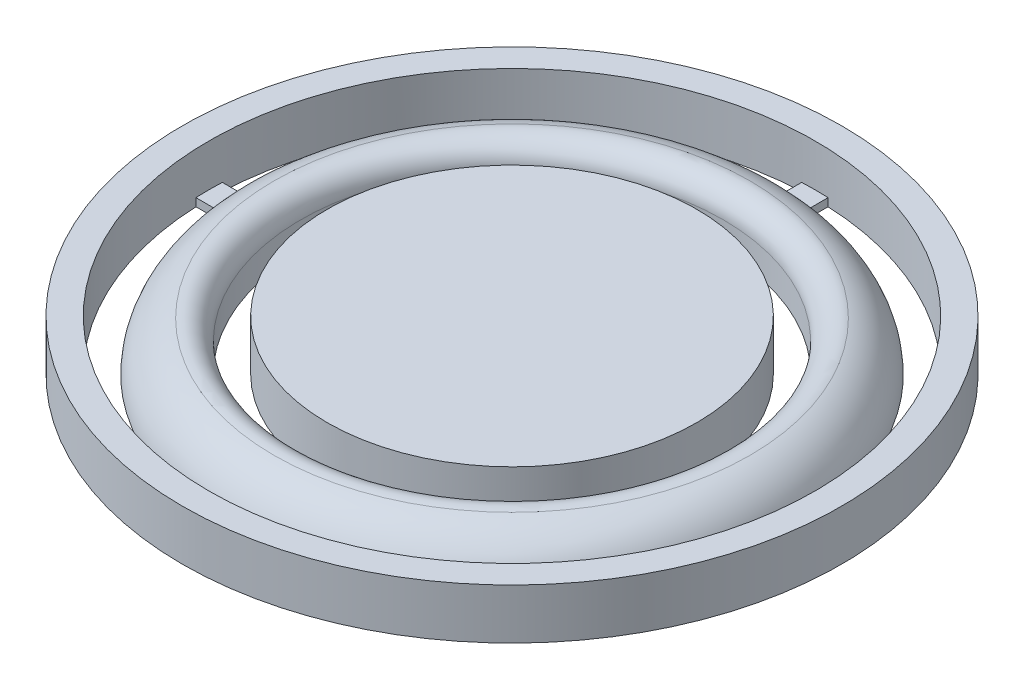
from build123d import *

# Parameters (mm, degrees)
SKETCH1_R           = 105
SKETCH1_R_2         = 80
BOSS_EXTRUDE1_DEPTH = 19.05
FILLET4_R           = 8
SKETCH6_W           = 10
SKETCH6_H           = 114.826624275
BOSS_EXTRUDE2_DEPTH = 3
CIRPATTERN2_COUNT   = 4
SKETCH5_R           = 124.826624275
SKETCH5_R_2         = 114.826624275
SKETCH5_R_3         = 70
BOSS_EXTRUDE3_DEPTH = 19.05


with BuildPart() as part:
    # Sketch1 → Boss-Extrude1 (new body)
    with BuildSketch(Plane(origin=(0, 0, 0), x_dir=(1, 0, 0), z_dir=(0, 1, 0))):
        with Locations(Location((0, 0, 0), (0, 0, 90))):
            Circle(SKETCH1_R)
        with Locations(Location((0, 0, 0), (0, 0, 90))):
            Circle(SKETCH1_R_2, mode=Mode.SUBTRACT)
    extrude(amount=BOSS_EXTRUDE1_DEPTH)

    # Sketch3 → Cut-Revolve1 (revolve, cut)
    with BuildSketch(Plane.XY, mode=Mode.PRIVATE) as cut_revolve1_sk:
        with BuildLine():
            Line((-84.849199516, 19.05), (-84.849199516, 24.05))
            Line((-84.849199516, 24.05), (-110, 24.05))
            Line((-110, 24.05), (-110, 0))
            Line((-110, 0), (-104.826624275, 0))
            ThreePointArc((-104.826624275, 0), (-98.651373258, 13.524114826), (-84.849199516, 19.05))
        make_face()
    revolve(cut_revolve1_sk.sketch.rotate(Axis((0, 0, 0), (0, 1, 0)), 270), axis=Axis((0, 0, 0), (0, 1, 0)), mode=Mode.SUBTRACT)

    # Fillet4
    fillet4_edges = [part.edges().sort_by_distance(p)[0] for p in [
        (0, 19.05, 80),
    ]]
    fillet(fillet4_edges, radius=FILLET4_R)

    # Sketch6 → Boss-Extrude2 (add)
    with BuildSketch(Plane(origin=(0, 0, 0), x_dir=(1, 0, 0), z_dir=(0, 1, 0))):
        with Locations((0, 57.413312138)):
            Rectangle(SKETCH6_W, SKETCH6_H)
    boss_extrude2 = extrude(amount=BOSS_EXTRUDE2_DEPTH)

    # CirPattern2: Boss-Extrude2 ×4 about axis
    cirpattern2_axis = Axis((0, 0, 0), (0, 1, 0))
    for i in range(1, CIRPATTERN2_COUNT):
        add(boss_extrude2.rotate(cirpattern2_axis, i * 360 / CIRPATTERN2_COUNT))

    # Sketch5 → Boss-Extrude3 (add)
    # profile 1 of 2: a face of its own
    with BuildSketch(Plane(origin=(0, 0, 0), x_dir=(1, 0, 0), z_dir=(0, 1, 0))):
        with Locations(Location((0, 0, 0), (0, 0, 90))):
            Circle(SKETCH5_R)
        with Locations(Location((0, 0, 0), (0, 0, 87.504328744))):
            Circle(SKETCH5_R_2, mode=Mode.SUBTRACT)
    # profile 2 of 2: a face of its own
    with BuildSketch(Plane(origin=(0, 0, 0), x_dir=(1, 0, 0), z_dir=(0, 1, 0))):
        with Locations(Location((0, 0, 0), (0, 0, 85.903956242))):
            Circle(SKETCH5_R_3)
    extrude(amount=BOSS_EXTRUDE3_DEPTH)


solid = part.part
